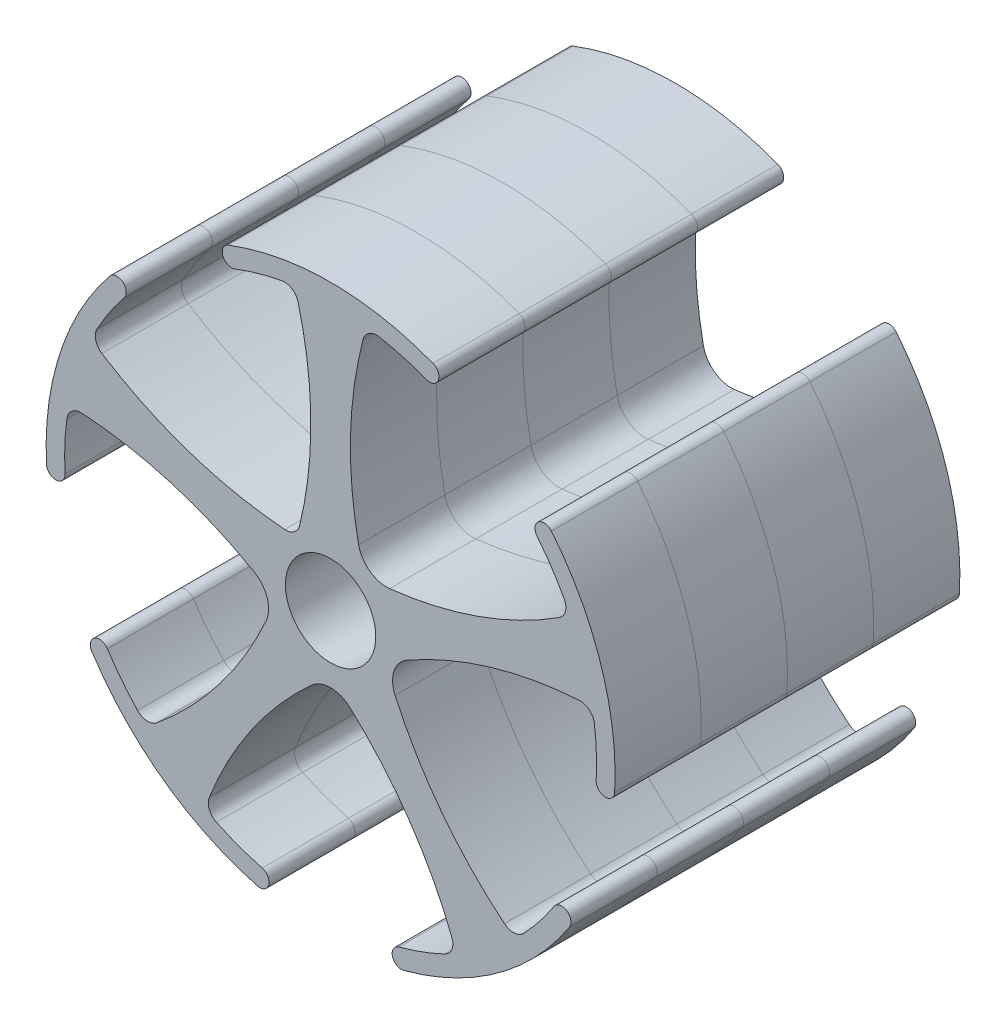
from build123d import *
from OCP.BRepFilletAPI import BRepFilletAPI_MakeFillet

# Parameters (mm, degrees)
BOSS_EXTRUDE3_DEPTH = 3.03
CIRPATTERN1_COUNT   = 5
SKETCH6_R           = 1.5875
CUT_EXTRUDE1_DEPTH  = 82
FILLET1_R1          = 0.5
FILLET1_R2          = 1
LPATTERN1_COUNT     = 4
LPATTERN1_PITCH     = 3.03


with BuildPart() as part:
    # Sketch2 → Boss-Extrude3 (new body)
    with BuildSketch(Plane.XY):
        with BuildLine():
            Line((-1.754642488, 0), (1.754642488, 0))
            ThreePointArc((1.754642488, 0), (0.715235243, 4.589712491), (1.262652519, 9.263700349))
            ThreePointArc((1.262652519, 9.263700349), (2.329629225, 9.054460956), (3.365097849, 8.722760572))
            ThreePointArc((3.365097849, 8.722760572), (3.785710126, 8.909187203), (3.599283495, 9.329799479))
            ThreePointArc((3.599283495, 9.329799479), (0, 10), (-3.599283495, 9.329799479))
            ThreePointArc((-3.599283495, 9.329799479), (-3.785710126, 8.909187203), (-3.365097849, 8.722760572))
            ThreePointArc((-3.365097849, 8.722760572), (-2.329629225, 9.054460956), (-1.262652519, 9.263700349))
            ThreePointArc((-1.262652519, 9.263700349), (-0.715235243, 4.589712491), (-1.754642488, 0))
        make_face()
    extrude(amount=-BOSS_EXTRUDE3_DEPTH)

    # CirPattern1: part ×5 about axis
    cirpattern1_axis = Axis((0, 0, 0), (0, 0, -1))


with BuildPart() as part_1:
    add(part.part)
    for i in range(1, CIRPATTERN1_COUNT):
        add(part.part.rotate(cirpattern1_axis, i * 360 / CIRPATTERN1_COUNT))

    # Sketch6 → Cut-Extrude1 (cut)
    with BuildSketch(Plane(origin=(0, 0, -3.03), x_dir=(-1, 0, 0), z_dir=(0, 0, -1))):
        Circle(SKETCH6_R)
    extrude(amount=-CUT_EXTRUDE1_DEPTH, mode=Mode.SUBTRACT)

    # Fillet1: one fillet with a radius per group of edges: ONE call of the kernel's fillet builder (fillet() takes one radius for all edges)
    fillet1_edges_1 = [part_1.edges().sort_by_distance(p)[0] for p in [
        (-1.192367006, 1.64115239, -1.515),
        (-1.262652519, 9.263700349, -1.515),
        (1.262652519, 9.263700349, -1.515),
        (-8.420121495, 4.063494744, -1.515),
        (-9.200483668, 1.661786933, -1.515),
        (-6.466573792, -6.752322484, -1.515),
        (6.466573792, -6.752322484, -1.515),
        (-4.423559101, -8.236659542, -1.515),
        (4.423559101, -8.236659542, -1.515),
        (9.200483668, 1.661786933, -1.515),
        (8.420121495, 4.063494744, -1.515),
    ]]
    fillet1_edges_2 = [part_1.edges().sort_by_distance(p)[0] for p in [
        (-1.929290343, -0.626864432, -1.515),
        (0, -2.028575916, -1.515),
        (1.929290343, -0.626864432, -1.515),
        (1.192367006, 1.64115239, -1.515),
    ]]
    fillet1 = BRepFilletAPI_MakeFillet(part_1.part.solid().wrapped)
    for e in fillet1_edges_1:
        fillet1.Add(FILLET1_R1, e.wrapped)
    for e in fillet1_edges_2:
        fillet1.Add(FILLET1_R2, e.wrapped)
    add(Compound.cast(fillet1.Shape()), mode=Mode.REPLACE)


with BuildPart() as lpattern1_1:
    # LPattern1: pattern copy
    add(part_1.part.moved(Location(Vector(0, 0, 1) * (1 * LPATTERN1_PITCH))))


with BuildPart() as lpattern1_2:
    # LPattern1: pattern copy
    add(part_1.part.moved(Location(Vector(0, 0, 1) * (2 * LPATTERN1_PITCH))))


with BuildPart() as lpattern1_3:
    # LPattern1: pattern copy
    add(part_1.part.moved(Location(Vector(0, 0, 1) * (3 * LPATTERN1_PITCH))))


solid = Compound([part_1.part, lpattern1_1.part, lpattern1_2.part, lpattern1_3.part])
